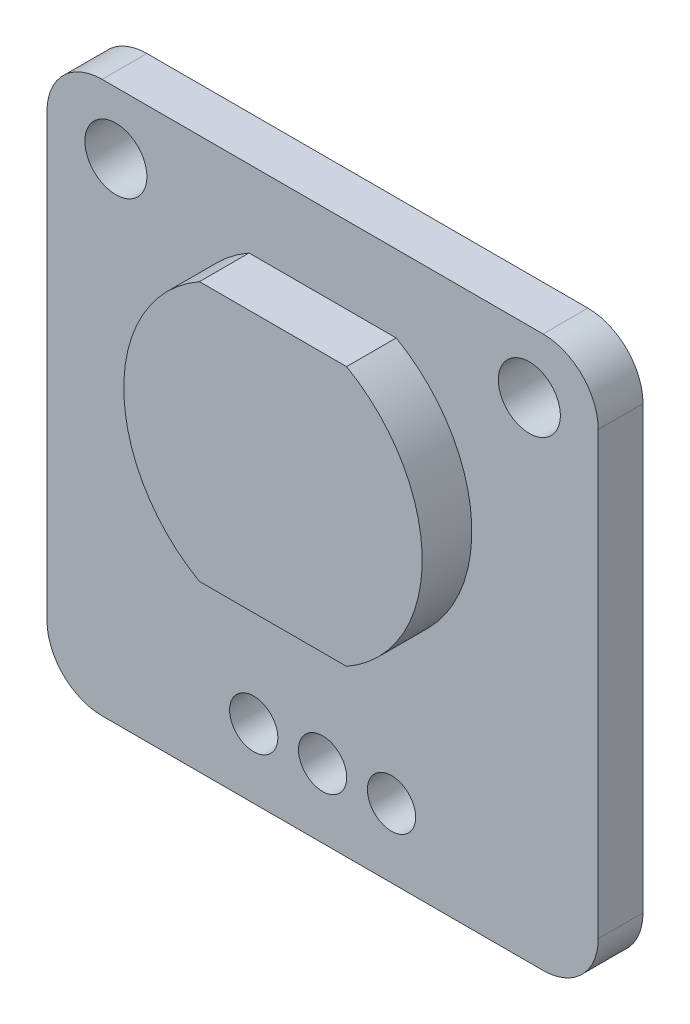
from build123d import *

# Parameters (mm, degrees)
SKETCH1_R           = 1.143
SKETCH1_R_2         = 0.889
BOSS_EXTRUDE1_DEPTH = 1.651
BOSS_EXTRUDE2_DEPTH = 1.8288


with BuildPart() as part:
    # Sketch1 → Boss-Extrude1 (new body)
    with BuildSketch(Plane.XY):
        with BuildLine():
            Line((-8.04553404, 11.028906935), (8.21046596, 11.028906935))
            ThreePointArc((8.21046596, 11.028906935), (9.647306939, 10.433747914), (10.24246596, 8.996906935))
            Line((10.24246596, 8.996906935), (10.24246596, -7.259093065))
            ThreePointArc((10.24246596, -7.259093065), (9.647306939, -8.695934044), (8.21046596, -9.291093065))
            Line((8.21046596, -9.291093065), (-8.04553404, -9.291093065))
            ThreePointArc((-8.04553404, -9.291093065), (-9.48237502, -8.695934044), (-10.07753404, -7.259093065))
            Line((-10.07753404, -7.259093065), (-10.07753404, 8.996906935))
            ThreePointArc((-10.07753404, 8.996906935), (-9.48237502, 10.433747914), (-8.04553404, 11.028906935))
        make_face()
        with Locations(Location((-7.53753404, 8.742906935, 0), (0, 0, 180))):
            Circle(SKETCH1_R, mode=Mode.SUBTRACT)
        with Locations(Location((7.70246596, 8.742906935, 0), (0, 0, 180))):
            Circle(SKETCH1_R, mode=Mode.SUBTRACT)
        with Locations(Location((0.08246596, -6.751093065, 0), (0, 0, 180))):
            Circle(SKETCH1_R_2, mode=Mode.SUBTRACT)
        with Locations(Location((2.62246596, -6.751093065, 0), (0, 0, 180))):
            Circle(SKETCH1_R_2, mode=Mode.SUBTRACT)
        with Locations(Location((-2.45753404, -6.751093065, 0), (0, 0, 180))):
            Circle(SKETCH1_R_2, mode=Mode.SUBTRACT)
    extrude(amount=BOSS_EXTRUDE1_DEPTH)

    # Sketch2 → Boss-Extrude2 (add)
    with BuildSketch(Plane.XY.offset(1.651)):
        with BuildLine():
            Line((2.794250427, 8.193906935), (-2.629318508, 8.193906935))
            ThreePointArc((-2.629318508, 8.193906935), (-5.41753404, 3.408906935), (-2.629318508, -1.376093065))
            Line((-2.629318508, -1.376093065), (2.794250427, -1.376093065))
            ThreePointArc((2.794250427, -1.376093065), (5.58246596, 3.408906935), (2.794250427, 8.193906935))
        make_face()
    extrude(amount=BOSS_EXTRUDE2_DEPTH)


solid = part.part
